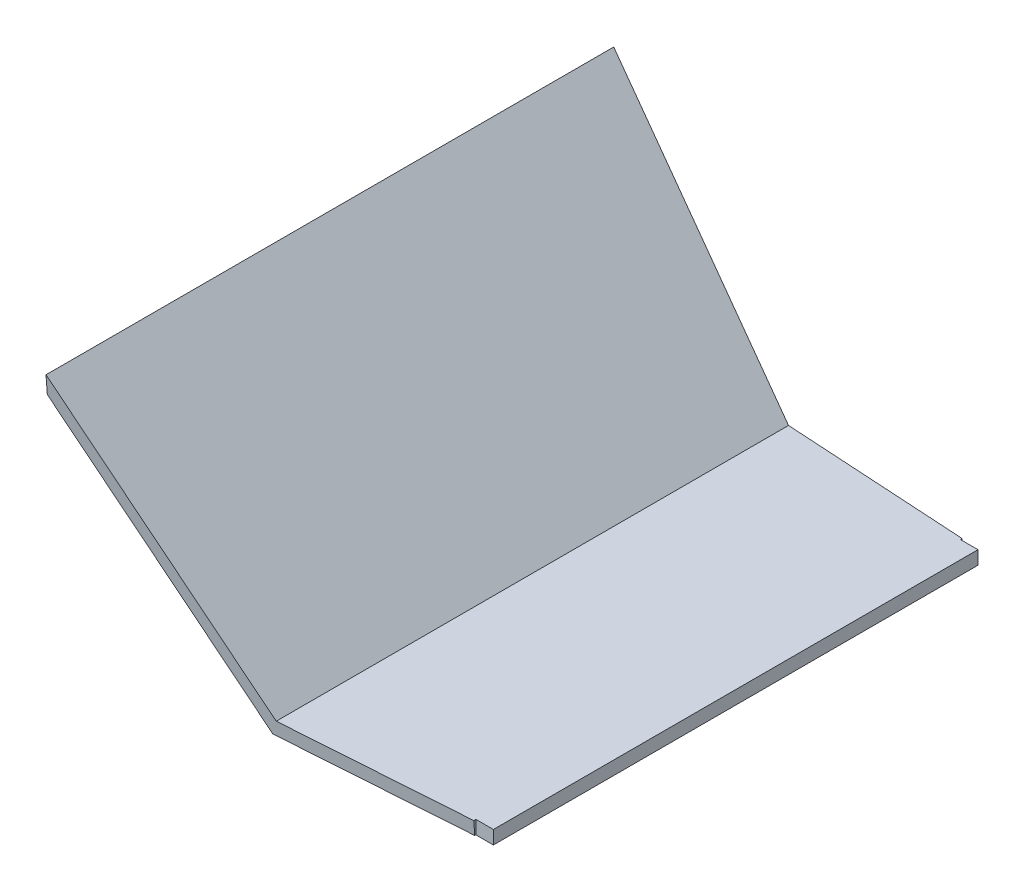
from build123d import *

# Parameters (mm, degrees)
BOSS_EXTRUDE1_DEPTH     = 5.08
CUT_EXTRUDE1_DEPTH      = 50.8
SKETCH3_W               = 34.377834067
SKETCH3_H               = 141.590062345
CUT_EXTRUDE2_DEPTH      = 25.4
SKETCH4_R               = 1.4224
CUT_EXTRUDE3_DEPTH      = 5.08
BOSS_EXTRUDE2_DEPTH     = 164.338
CUT_EXTRUDE4_DEPTH      = 152.4
CUT_EXTRUDE5_DEPTH      = 152.4
CUT_EXTRUDE5_DEPTH_BACK = 152.4
SKETCH8_W               = 19.066411764
SKETCH8_H               = 17.374579431
SKETCH8_W_2             = 17.073824451
CUT_EXTRUDE6_DEPTH      = 5.08


with BuildPart() as part:
    # Sketch1 → Boss-Extrude1 (new body)
    with BuildSketch(Plane.XY):
        Polygon((0, 0), (0, 216.543480298), (-101.237370502, 216.543480298), (-101.237370502, 120.65), align=None)
    extrude(amount=BOSS_EXTRUDE1_DEPTH)

    # Sketch2 → Cut-Extrude1 (cut)
    with BuildSketch(Plane.XY.offset(5.08)):
        Polygon((-101.237370502, 216.543480298), (0, 108.271740149), (0, 216.543480298), align=None)
    extrude(amount=-CUT_EXTRUDE1_DEPTH, mode=Mode.SUBTRACT)

    # Sketch3 → Cut-Extrude2 (cut)
    with BuildSketch(Plane.XY.offset(5.08)):
        with Locations((5.61014441, 62.39317364)):
            Rectangle(SKETCH3_W, SKETCH3_H)
    extrude(amount=-CUT_EXTRUDE2_DEPTH, mode=Mode.SUBTRACT)

    # Sketch4 → Cut-Extrude3 (cut)
    with BuildSketch(Plane(origin=(0, 0, 0), x_dir=(0, 0, 1), z_dir=(-0.7660444431189743, -0.6427876096865437, 0))):
        with Locations((2.54, 26.412934343)):
            Circle(SKETCH4_R)
        with Locations((2.54, 153.412934343)):
            Circle(SKETCH4_R)
    extrude(amount=-CUT_EXTRUDE3_DEPTH, mode=Mode.SUBTRACT)

    # Sketch5 → Boss-Extrude2 (add)
    with BuildSketch(Plane.XY.offset(5.08)):
        Polygon((-101.237370502, 216.543480298), (-101.237370502, 221.697031777), (-43.160539618, 159.601331401), (15.407326332, 159.601331401), (15.407326332, 155.702260244), (-44.348979053, 155.702260244), align=None)
    extrude(amount=-BOSS_EXTRUDE2_DEPTH)

    # Sketch6 → Cut-Extrude4 (cut)
    with BuildSketch(Plane(origin=(0, 0, -63.5), x_dir=(-1, 0, 0), z_dir=(0, 0, -1))):
        Polygon((11.578772624, 120.655051318), (11.578772624, 13.799043873), (101.237370502, 120.65), (101.237370502, 216.543480298), align=None)
    extrude(amount=-CUT_EXTRUDE4_DEPTH, mode=Mode.SUBTRACT)

    # Sketch7 → Cut-Extrude5 (cut, two sides: drawn at the far end of the back side and taken through both)
    with BuildSketch(Plane(origin=(56.600313361, 52.937108481, 0), x_dir=(0, 0, -1), z_dir=(0.7303459019409237, 0.6830774945188128, 0)).offset(-CUT_EXTRUDE5_DEPTH_BACK)):
        Polygon((-5.08, 231.068488025), (7.526341611, 106.039780465), (-5.08, 106.039780465), align=None)
        Polygon((159.258, 231.068488025), (148.255408438, 106.039780465), (159.258, 106.039780465), align=None)
    extrude(amount=CUT_EXTRUDE5_DEPTH + CUT_EXTRUDE5_DEPTH_BACK, mode=Mode.SUBTRACT)

    # Sketch8 → Cut-Extrude6 (cut)
    with BuildSketch(Plane(origin=(15.407326332, 0, 0), x_dir=(0, 0, -1), z_dir=(1, 0, 0))):
        with Locations((-1.754260648, 156.68928868)):
            Rectangle(SKETCH8_W, SKETCH8_H)
        with Locations((156.594427777, 156.68928868)):
            Rectangle(SKETCH8_W_2, SKETCH8_H)
    extrude(amount=-CUT_EXTRUDE6_DEPTH, mode=Mode.SUBTRACT)


solid = part.part
